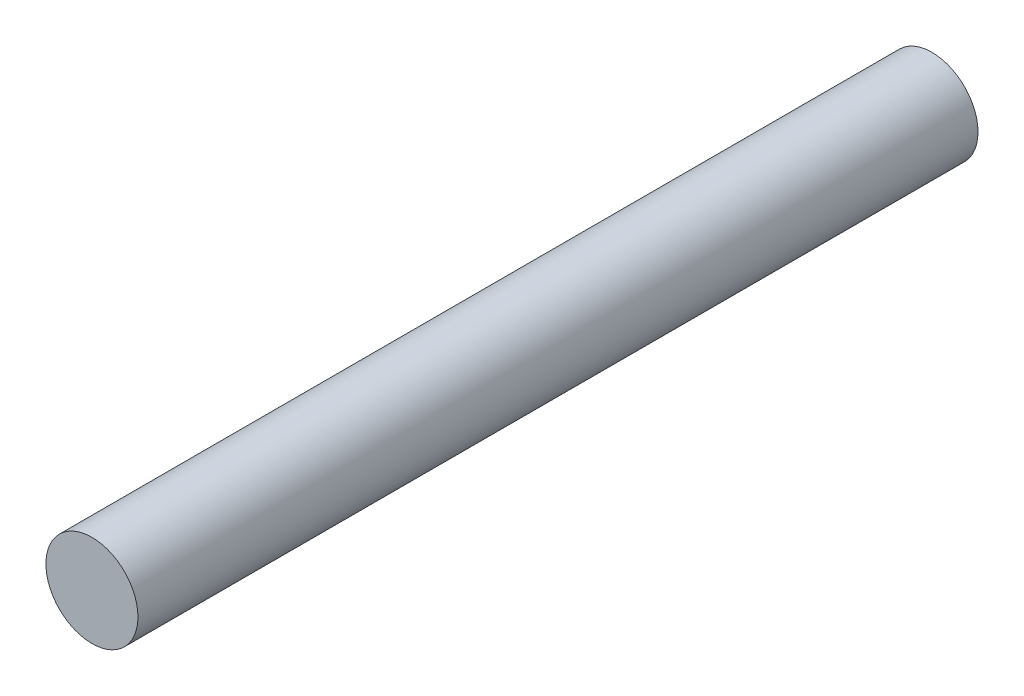
from build123d import *

# Parameters (mm, degrees)
SKETCH_1_R      = 0.8
EXTRUDE_1_DEPTH = 14.6


with BuildPart() as part:
    # 草图1 → 凸台-拉伸1 (new body)
    with BuildSketch(Plane.XY):
        Circle(SKETCH_1_R)
    extrude(amount=EXTRUDE_1_DEPTH)


solid = part.part
